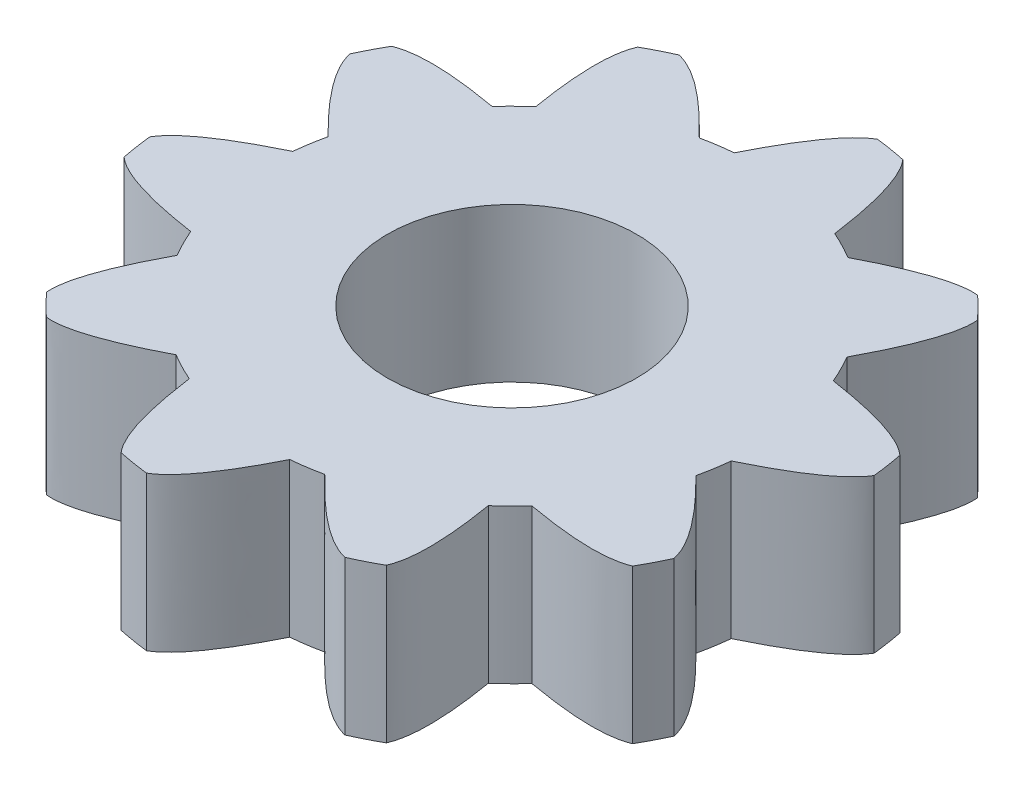
from build123d import *

# Parameters (mm, degrees)
SKETCH1_R           = 7.957747155
BOSS_EXTRUDE4_DEPTH = 5
CIRPATTERN6_COUNT   = 10
SKETCH2_R           = 4.05
CUT_EXTRUDE1_DEPTH  = 10


with BuildPart() as part:
    # Sketch1 → Boss-Extrude4 (new body)
    with BuildSketch(Plane(origin=(0, 0, 0), x_dir=(1, 0, 0), z_dir=(0, 1, 0))):
        Circle(SKETCH1_R)
        with BuildLine():
            ThreePointArc((7.958110252, 7.164089255), (7.788629845, 7.347988758), (7.614900879, 7.527880064))
            ThreePointArc((7.614900879, 7.527880064), (7.43701812, 7.703665045), (7.255078601, 7.875247815))
            add(Edge.make_bspline(
                [(7.255078601, 7.875247815), (6.306550312, 7.97741942), (4.090117658, 6.826175893)],
                knots=[0.62632571, 0.62632571, 0.62632571, 1, 1, 1], degree=2))
            ThreePointArc((4.090117658, 6.826175893), (5.659220003, 5.594548126), (6.872732742, 4.011394325))
            add(Edge.make_bspline(
                [(6.872732742, 4.011394325), (8.04937368, 6.214449356), (7.958110252, 7.164089255)],
                knots=[0, 0, 0, 0.37367429, 0.37367429, 0.37367429], degree=2))
        make_face()
    boss_extrude4 = extrude(amount=BOSS_EXTRUDE4_DEPTH)

    # CirPattern6: Boss-Extrude4 ×10 about axis
    cirpattern6_axis = Axis((0, 0, 0), (0, -1, 0))
    for i in range(1, CIRPATTERN6_COUNT):
        add(boss_extrude4.rotate(cirpattern6_axis, i * 360 / CIRPATTERN6_COUNT))

    # Sketch2 → Cut-Extrude1 (cut)
    with BuildSketch(Plane(origin=(0, 5, 0), x_dir=(1, 0, 0), z_dir=(0, 1, 0))):
        with Locations(Location((0, 0, 0), (0, 0, 270))):
            Circle(SKETCH2_R)
    extrude(amount=-CUT_EXTRUDE1_DEPTH, mode=Mode.SUBTRACT)


solid = part.part
